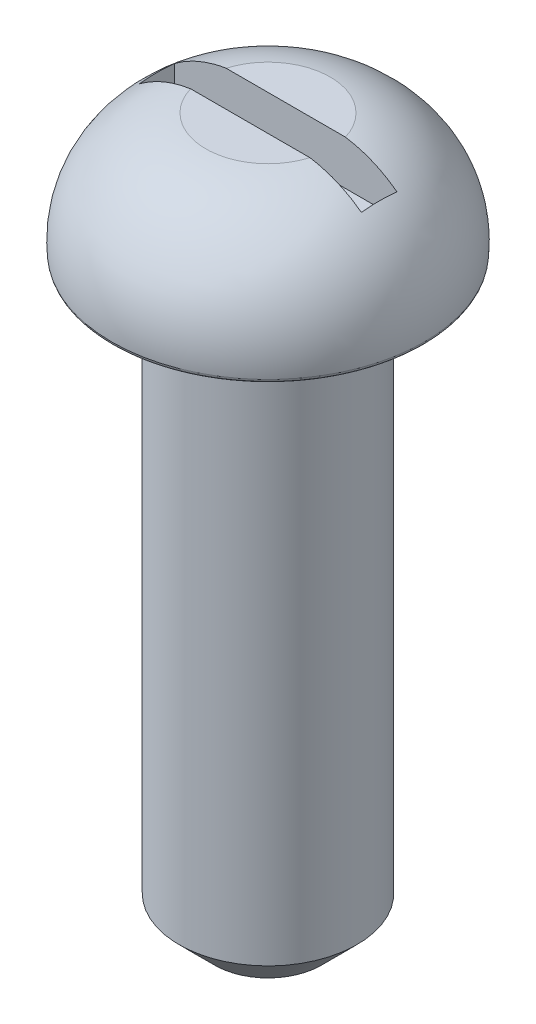
from build123d import *

# Parameters (mm, degrees)
FILLET_1_R          = 0.1
SKETCH_3_W          = 5
SKETCH_3_H          = 0.8
CUT_EXTRUDE_2_DEPTH = 1


with BuildPart() as part:
    # Эскиз1 → Повернуть1 (revolve)
    with BuildSketch(Plane.XY):
        with BuildLine():
            Line((3.5, 13.2), (2, 13.2))
            Line((2, 13.2), (2, 0.8))
            Line((2, 0.8), (1.2, 0))
            Line((1.2, 0), (0, 0))
            Line((0, 0), (0, 16))
            Line((0, 16), (1.4, 16))
            ThreePointArc((1.4, 16), (3.015564437, 15.024173328), (3.5, 13.2))
        make_face()
    revolve(axis=Axis((0, 0, 0), (0, 1, 0)))

    # Скругление1
    fillet_1_edges = [part.edges().sort_by_distance(p)[0] for p in [
        (-3.5, 13.2, 0),
    ]]
    fillet(fillet_1_edges, radius=FILLET_1_R)

    # Эскиз3 → Вырез-Вытянуть2 (cut)
    with BuildSketch(Plane(origin=(0, 16, 0), x_dir=(-1, 0, 0), z_dir=(0, 1, 0))):
        Rectangle(SKETCH_3_W, SKETCH_3_H)
    extrude(amount=-CUT_EXTRUDE_2_DEPTH, mode=Mode.SUBTRACT)


solid = part.part
